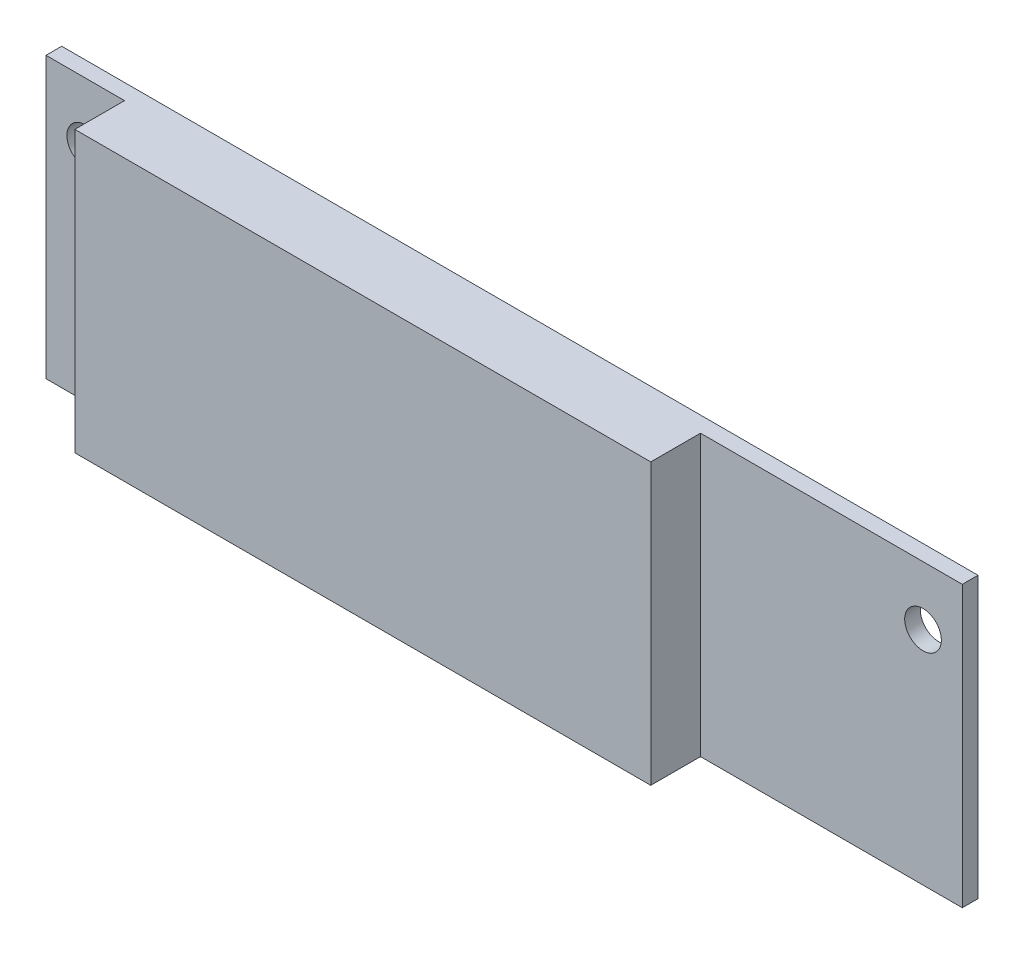
from build123d import *

# Parameters (mm, degrees)
SKETCH1_W           = 70
SKETCH1_H           = 21.4
BOSS_EXTRUDE1_DEPTH = 5
SKETCH2_W           = 6
SKETCH2_H           = 21.4
SKETCH2_W_2         = 20
CUT_EXTRUDE1_DEPTH  = 3.8
SKETCH3_R           = 1.4
CUT_EXTRUDE2_DEPTH  = 46.232731512


with BuildPart() as part:
    # Sketch1 → Boss-Extrude1 (new body)
    with BuildSketch(Plane.XY):
        with Locations((0, 17.7)):
            Rectangle(SKETCH1_W, SKETCH1_H)
    extrude(amount=BOSS_EXTRUDE1_DEPTH)

    # Sketch2 → Cut-Extrude1 (cut)
    with BuildSketch(Plane.XY.offset(5)):
        with Locations((-32, 17.7)):
            Rectangle(SKETCH2_W, SKETCH2_H)
        with Locations((25, 17.7)):
            Rectangle(SKETCH2_W_2, SKETCH2_H)
    extrude(amount=-CUT_EXTRUDE1_DEPTH, mode=Mode.SUBTRACT)

    # Sketch3 → Cut-Extrude2 (cut, through all)
    with BuildSketch(Plane.XY.offset(1.2)):
        with Locations((32, 23.9)):
            Circle(SKETCH3_R)
        with Locations((-32, 23.9)):
            Circle(SKETCH3_R)
    extrude(amount=-CUT_EXTRUDE2_DEPTH, mode=Mode.SUBTRACT)


solid = part.part
